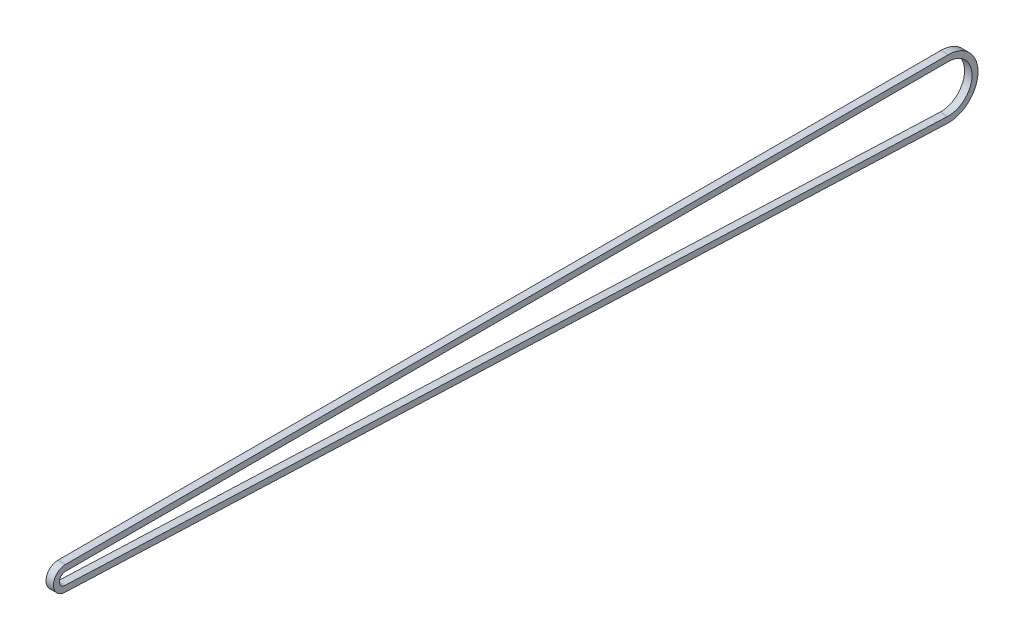
from build123d import *

# Parameters (mm, degrees)
EXTRUDE_1_DEPTH = 5


with BuildPart() as part:
    # ｽｹｯﾁ1 → ﾎﾞｽ - 押し出し1 (new body)
    with BuildSketch(Plane(origin=(0, 0, 0), x_dir=(0, 0, -1), z_dir=(1, 0, 0))):
        with BuildLine():
            Line((590.52, 8), (0, 8))
            ThreePointArc((0, 8), (-7.998416793, 0.159150236), (-0.31823748, -7.993667801))
            Line((-0.31823748, -7.993667801), (589.734351221, -31.484367383))
            ThreePointArc((589.734351221, -31.484367383), (610.266091459, -12.142902145), (590.52, 8))
        make_face()
        with BuildLine():
            ThreePointArc((-0.15911874, -3.9968339), (-3.999208397, 0.079575118), (0, 4))
            Line((0, 4), (590.52, 4))
            ThreePointArc((590.52, 4), (601.656931804, -0.613068196), (606.27, -11.75))
            ThreePointArc((606.27, -11.75), (601.43317213, -23.106283461), (589.893469961, -27.487533482))
            Line((589.893469961, -27.487533482), (-0.15911874, -3.9968339))
        make_face(mode=Mode.SUBTRACT)
    extrude(amount=EXTRUDE_1_DEPTH)


solid = part.part
